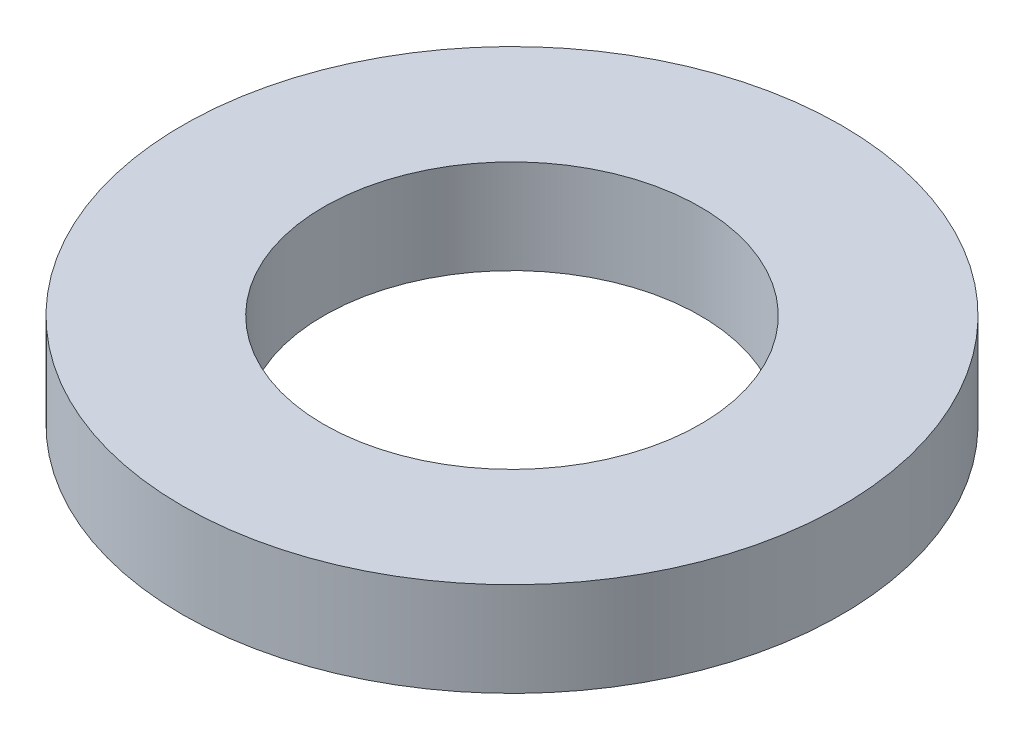
from build123d import *

# Parameters (mm, degrees)
SKETCH1_R           = 3.5
SKETCH1_R_2         = 2
BOSS_EXTRUDE1_DEPTH = 1


with BuildPart() as part:
    # Sketch1 → Boss-Extrude1 (new body)
    with BuildSketch(Plane(origin=(0, 0, 0), x_dir=(1, 0, 0), z_dir=(0, 1, 0))):
        with Locations(Location((0, 0, 0), (0, 0, 270))):
            Circle(SKETCH1_R)
        with Locations(Location((0, 0, 0), (0, 0, 270))):
            Circle(SKETCH1_R_2, mode=Mode.SUBTRACT)
    extrude(amount=BOSS_EXTRUDE1_DEPTH)


solid = part.part
